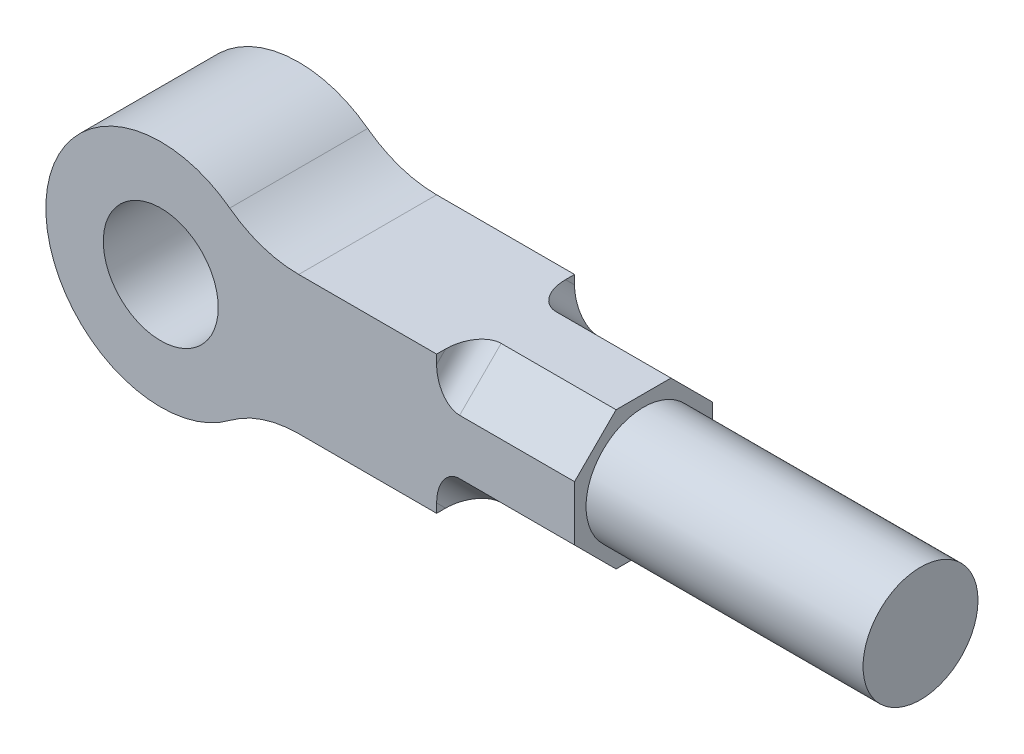
from build123d import *

# Parameters (mm, degrees)
SKETCH1_R           = 25
BOSS_EXTRUDE1_DEPTH = 60
CUT_EXTRUDE1_DEPTH  = 60
SKETCH2_3_R         = 25
BOSS_EXTRUDE2_DEPTH = 120.5
FILLET1_R           = 10


with BuildPart() as part:
    # Sketch1 → Boss-Extrude1 (new body)
    with BuildSketch(Plane.XY):
        with BuildLine():
            Line((60, 30), (180, 30))
            Line((180, 30), (180, -30))
            Line((180, -30), (60, -30))
            ThreePointArc((60, -30), (44.188611699, -32.565835097), (30, -40))
            ThreePointArc((30, -40), (-50, 0), (30, 40))
            ThreePointArc((30, 40), (44.188611699, 32.565835097), (60, 30))
        make_face()
        Circle(SKETCH1_R, mode=Mode.SUBTRACT)
    extrude(amount=BOSS_EXTRUDE1_DEPTH)

    # Sketch2 → Cut-Extrude1 (cut)
    with BuildSketch(Plane(origin=(180, 0, 0), x_dir=(0, 0, -1), z_dir=(1, 0, 0))):
        Polygon((0, 30), (-18.06, 30), (0, 11.94), align=None)
        Polygon((-60, 11.94), (-41.94, 30), (-60, 30), align=None)
        Polygon((0, -30), (0, -11.94), (-18.06, -30), align=None)
        Polygon((-41.94, -30), (-60, -11.94), (-60, -30), align=None)
    extrude(amount=-CUT_EXTRUDE1_DEPTH, mode=Mode.SUBTRACT)

    # Sketch2<3> → Boss-Extrude2 (add)
    with BuildSketch(Plane(origin=(180, 0, 0), x_dir=(0, 0, -1), z_dir=(1, 0, 0))):
        with Locations((-30, 0)):
            Circle(SKETCH2_3_R)
    extrude(amount=BOSS_EXTRUDE2_DEPTH)

    # Fillet1
    fillet1_edges = [part.edges().sort_by_distance(p)[0] for p in [
        (120, -20.97, 50.97),
        (120, -20.97, 9.03),
        (120, 20.97, 9.03),
        (120, 20.97, 50.97),
    ]]
    fillet(fillet1_edges, radius=FILLET1_R)


solid = part.part
